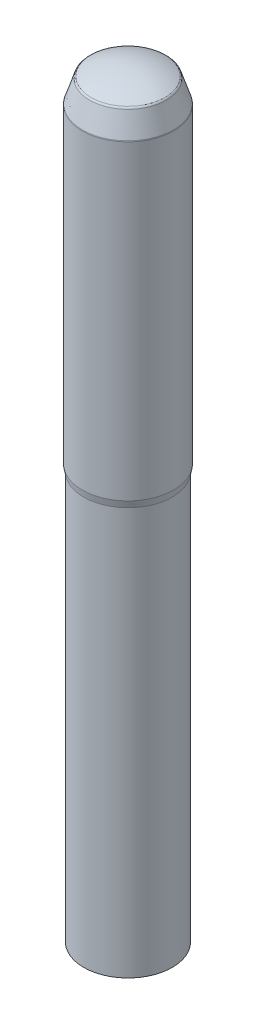
from build123d import *


with BuildPart() as part:
    # Esboço2 → Revolução1 (revolve)
    with BuildSketch(Plane.XY, mode=Mode.PRIVATE) as revolu_o1_sk:
        with BuildLine():
            Line((0, 0), (0, 29.3))
            Line((0, 29.3), (-0.1, 29.8))
            Line((-0.1, 29.8), (-0.1, 52.16829481))
            ThreePointArc((-0.1, 52.16829481), (-0.097533347, 52.199608972), (-0.090194233, 52.230150722))
            Line((-0.090194233, 52.230150722), (0.427794957, 53.822861152))
            ThreePointArc((0.427794957, 53.822861152), (0.466757595, 53.891883063), (0.529471576, 53.940350248))
            ThreePointArc((0.529471576, 53.940350248), (1.821567106, 54.403034378), (3.185, 54.56))
            Line((3.185, 54.56), (3.185, 0))
            Line((3.185, 0), (0, 0))
        make_face()
    revolve(revolu_o1_sk.sketch.rotate(Axis((3.185, 54.56, 0), (0, -1, 0)), 270), axis=Axis((3.185, 54.56, 0), (0, -1, 0)))


solid = part.part
